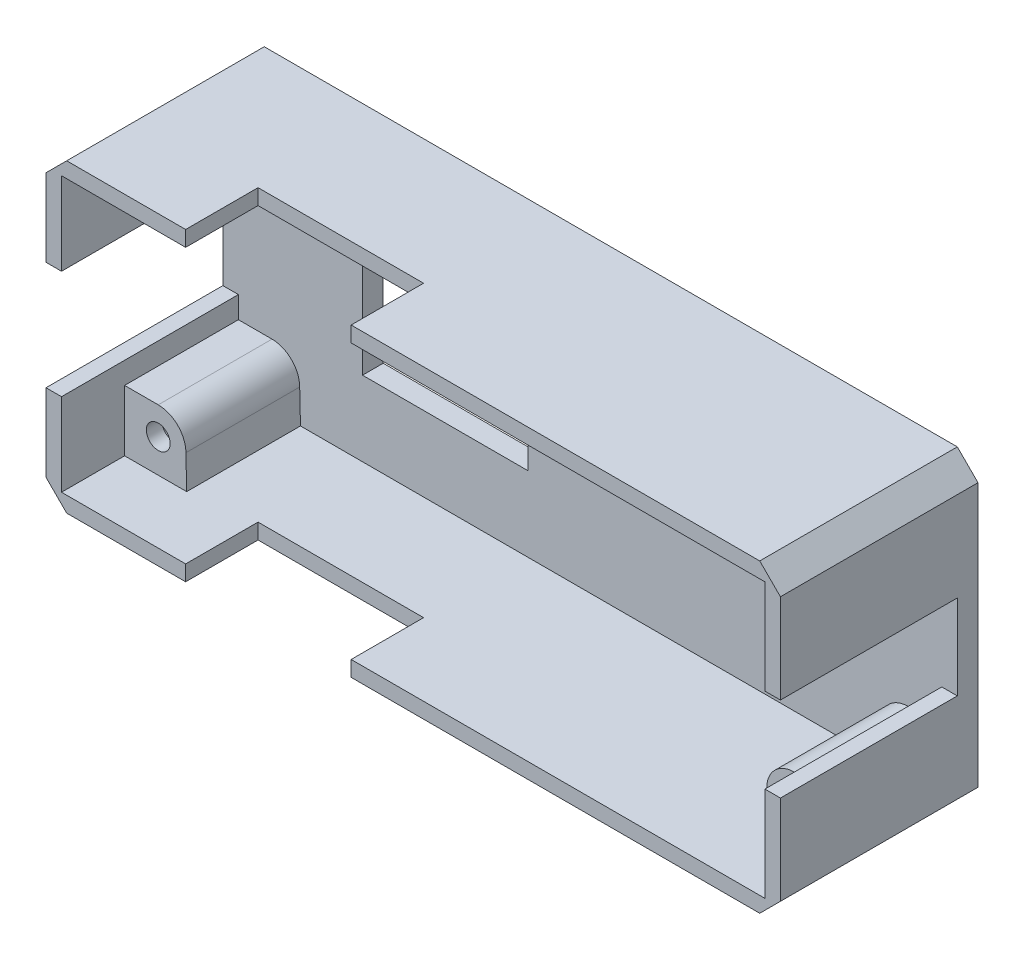
from build123d import *

# Parameters (mm, degrees)
SKETCH1_W           = 71
SKETCH1_H           = 29.5
SKETCH1_W_2         = 16
SKETCH1_H_2         = 12
BOSS_EXTRUDE2_DEPTH = 2
BOSS_EXTRUDE3_DEPTH = 17.1
SKETCH3_W           = 16
SKETCH3_H           = 7
CUT_EXTRUDE1_DEPTH  = 50.953077983
CHAMFER1_SIZE       = 2
BOSS_EXTRUDE4_DEPTH = 11
SKETCH8_R           = 1.15
CUT_EXTRUDE3_DEPTH  = 43.925778968
SKETCH9_R           = 2.175
CUT_EXTRUDE4_DEPTH  = 11.5


with BuildPart() as part:
    # Sketch1 → Boss-Extrude2 (new body)
    with BuildSketch(Plane.XY):
        Rectangle(SKETCH1_W, SKETCH1_H)
        with Locations((-14, 0)):
            Rectangle(SKETCH1_W_2, SKETCH1_H_2, mode=Mode.SUBTRACT)
    extrude(amount=BOSS_EXTRUDE2_DEPTH)

    # Sketch2 → Boss-Extrude3 (add)
    with BuildSketch(Plane.XY.offset(2)):
        Polygon((34, 13.25), (34, 4.1), (35.5, 4.1), (35.5, 14.75), (-35.5, 14.75), (-35.5, 5.25), (-34, 5.25), (-34, 13.25), align=None)
        Polygon((-34, -13.25), (34, -13.25), (34, -4.1), (35.5, -4.1), (35.5, -14.75), (-35.5, -14.75), (-35.5, -5.25), (-34, -5.25), align=None)
    extrude(amount=BOSS_EXTRUDE3_DEPTH)

    # Sketch3 → Cut-Extrude1 (cut, through all)
    with BuildSketch(Plane.XZ.offset(14.75)):
        with Locations((-14, 15.6)):
            Rectangle(SKETCH3_W, SKETCH3_H)
    extrude(amount=-CUT_EXTRUDE1_DEPTH, mode=Mode.SUBTRACT)

    # Chamfer1
    chamfer1_edges = [part.edges().sort_by_distance(p)[0] for p in [
        (-35.5, 14.75, 9.55),
        (35.5, 14.75, 9.55),
        (35.5, -14.75, 9.55),
        (-35.5, -14.75, 9.55),
    ]]
    chamfer(chamfer1_edges, length=CHAMFER1_SIZE)

    # Sketch7 → Boss-Extrude4 (add)
    with BuildSketch(Plane.XY.offset(2)):
        with BuildLine():
            Line((-34, 13.25), (-34, 7.355))
            Line((-34, 7.355), (-30.75, 7.355))
            ThreePointArc((-30.75, 7.355), (-28.85848936, 8.13848936), (-28.075, 10.03))
            Line((-28.075, 10.03), (-28, 13.25))
            Line((-28, 13.25), (-34, 13.25))
        make_face()
        with BuildLine():
            Line((34, 13.25), (28, 13.25))
            Line((28, 13.25), (28.075, 10.03))
            ThreePointArc((28.075, 10.03), (28.85848936, 8.13848936), (30.75, 7.355))
            Line((30.75, 7.355), (34, 7.355))
            Line((34, 7.355), (34, 13.25))
        make_face()
        with BuildLine():
            Line((-34, -13.25), (-28, -13.25))
            Line((-28, -13.25), (-28.075, -10.03))
            ThreePointArc((-28.075, -10.03), (-28.85848936, -8.13848936), (-30.75, -7.355))
            Line((-30.75, -7.355), (-34, -7.355))
            Line((-34, -7.355), (-34, -13.25))
        make_face()
        with BuildLine():
            Line((34, -13.25), (34, -7.355))
            Line((34, -7.355), (30.75, -7.355))
            ThreePointArc((30.75, -7.355), (28.85848936, -8.13848936), (28.075, -10.03))
            Line((28.075, -10.03), (28, -13.25))
            Line((28, -13.25), (34, -13.25))
        make_face()
    extrude(amount=BOSS_EXTRUDE4_DEPTH)

    # Sketch8 → Cut-Extrude3 (cut, through all)
    with BuildSketch(Plane(origin=(0, 0, 0), x_dir=(-1, 0, 0), z_dir=(0, 0, -1))):
        with Locations((30.75, 10.03)):
            Circle(SKETCH8_R)
        with Locations(Location((-30.75, 10.03, 0), (0, 0, 180))):
            Circle(SKETCH8_R)
        with Locations((-30.75, -10.03)):
            Circle(SKETCH8_R)
        with Locations(Location((30.75, -10.03, 0), (0, 0, 180))):
            Circle(SKETCH8_R)
    extrude(amount=-CUT_EXTRUDE3_DEPTH, mode=Mode.SUBTRACT)

    # Sketch9 → Cut-Extrude4 (cut)
    with BuildSketch(Plane(origin=(0, 0, 0), x_dir=(-1, 0, 0), z_dir=(0, 0, -1))):
        with Locations((30.75, 10.03)):
            Circle(SKETCH9_R)
        with Locations(Location((-30.75, 10.03, 0), (0, 0, 180))):
            Circle(SKETCH9_R)
        with Locations((-30.75, -10.03)):
            Circle(SKETCH9_R)
        with Locations(Location((30.75, -10.03, 0), (0, 0, 180))):
            Circle(SKETCH9_R)
    extrude(amount=-CUT_EXTRUDE4_DEPTH, mode=Mode.SUBTRACT)


solid = part.part
